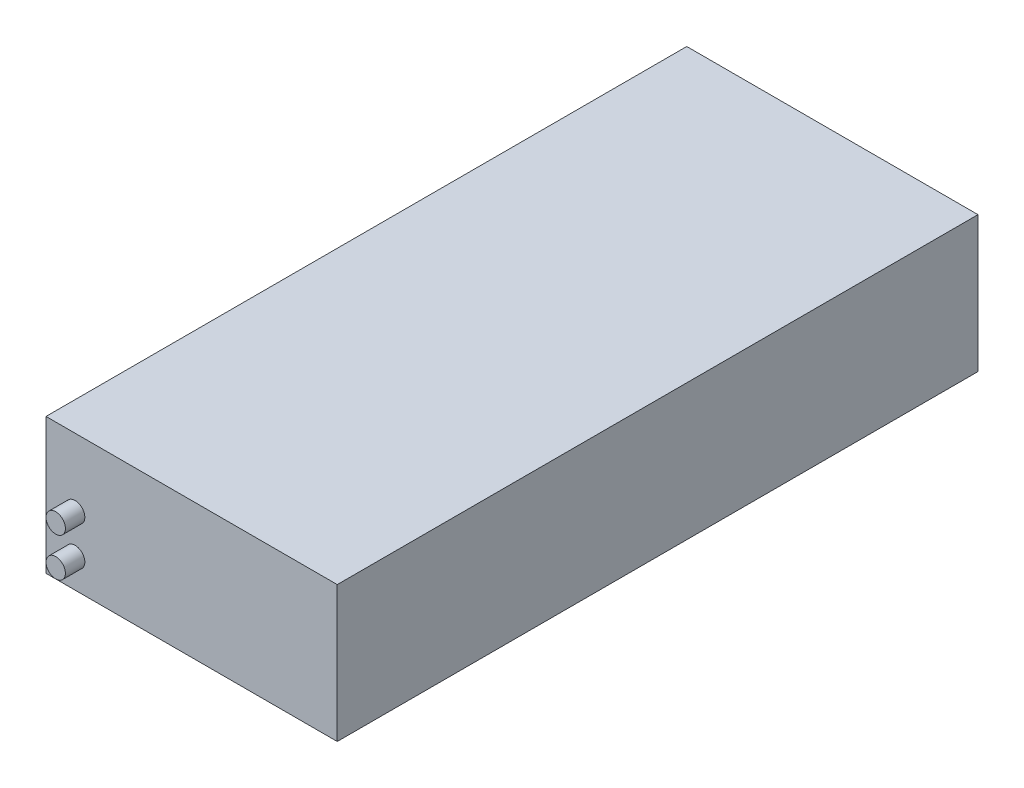
from build123d import *

# Parameters (mm, degrees)
SKETCH_1_W      = 150
SKETCH_1_H      = 70
EXTRUDE_1_DEPTH = 330
SKETCH_2_R      = 5
EXTRUDE_2_DEPTH = 10


with BuildPart() as part:
    # 草图1 → 凸台-拉伸1 (new body)
    with BuildSketch(Plane.XY):
        Rectangle(SKETCH_1_W, SKETCH_1_H)
    extrude(amount=EXTRUDE_1_DEPTH)

    # 草图2 → 凸台-拉伸2 (add)
    with BuildSketch(Plane.XY.offset(330)):
        with Locations((-60, 0)):
            Circle(SKETCH_2_R)
        with Locations((-60, -20)):
            Circle(SKETCH_2_R)
    extrude(amount=EXTRUDE_2_DEPTH)


solid = part.part
